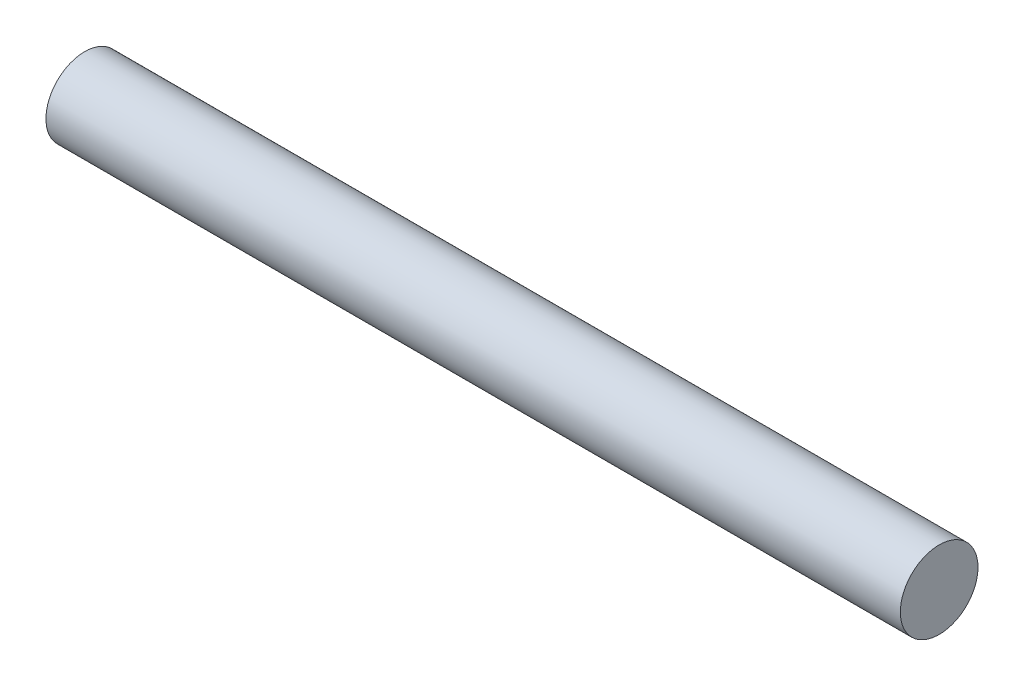
from build123d import *

# Parameters (mm, degrees)
SKETCH1_R           = 4
BOSS_EXTRUDE1_DEPTH = 44


with BuildPart() as part:
    # Sketch1 → Boss-Extrude1 (new, symmetric)
    with BuildSketch(Plane(origin=(0, 0, 0), x_dir=(0, 0, -1), z_dir=(1, 0, 0))):
        Circle(SKETCH1_R)
    extrude(amount=BOSS_EXTRUDE1_DEPTH, both=True)


solid = part.part
